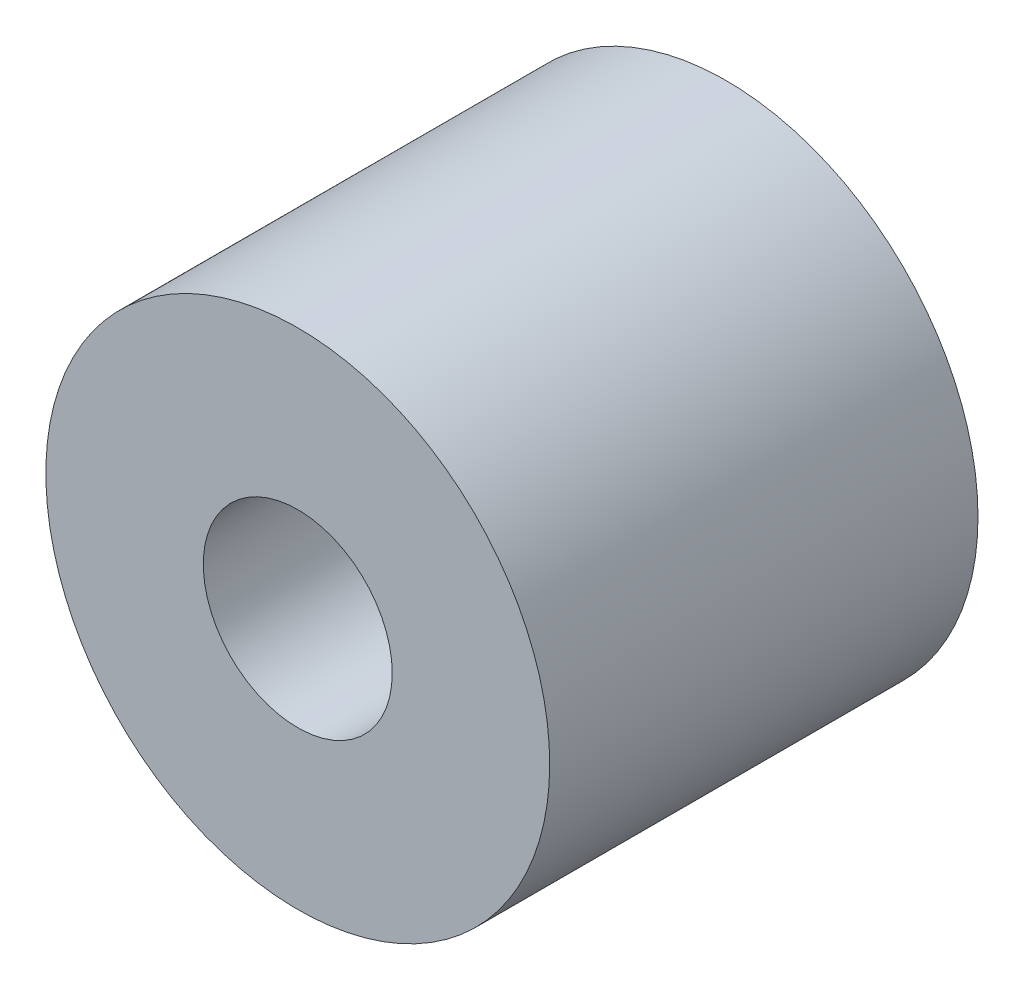
from build123d import *

# Parameters (mm, degrees)
SKETCH1_R           = 12.7
SKETCH1_R_2         = 4.7625
BOSS_EXTRUDE1_DEPTH = 21.59


with BuildPart() as part:
    # Sketch1 → Boss-Extrude1 (new body)
    with BuildSketch(Plane.XY):
        Circle(SKETCH1_R)
        Circle(SKETCH1_R_2, mode=Mode.SUBTRACT)
    extrude(amount=BOSS_EXTRUDE1_DEPTH)


solid = part.part
